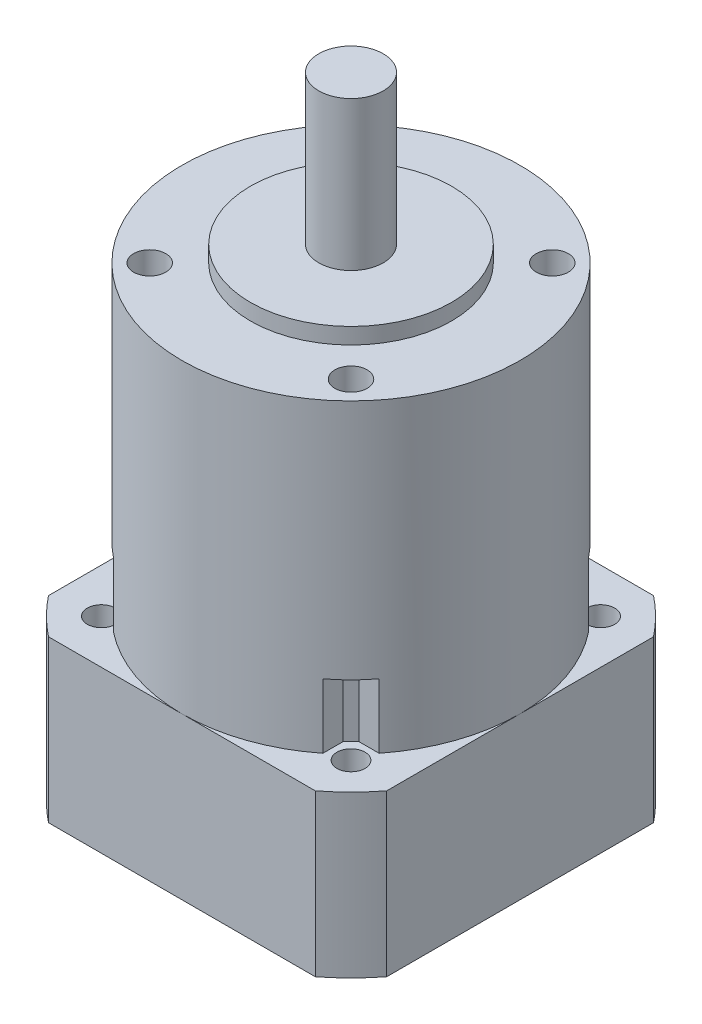
from build123d import *

# Parameters (mm, degrees)
EXTRUDE_1_DEPTH     = 20
SKETCH_2_R          = 21
EXTRUDE_2_DEPTH     = 38
SKETCH_3_R          = 12.5
EXTRUDE_3_DEPTH     = 2
SKETCH_4_R          = 4
EXTRUDE_4_DEPTH     = 18.5
SKETCH_5_R          = 1.75
CUT_EXTRUDE_1_DEPTH = 22.5
SKETCH_6_W          = 5
SKETCH_6_H          = 5
CUT_EXTRUDE_2_DEPTH = 8
CHAMFER_1_SIZE      = 1
SKETCH_7_R          = 12
CUT_EXTRUDE_3_DEPTH = 23
EXTRUDE_5_DEPTH     = 20
SKETCH_9_R          = 2
CUT_EXTRUDE_4_DEPTH = 13


with BuildPart() as part:
    # 草图1 → 凸台-拉伸1 (new body)
    with BuildSketch(Plane(origin=(0, 0, 0), x_dir=(1, 0, 0), z_dir=(0, 1, 0))):
        with BuildLine():
            Line((16.56992758, 21), (-16.56992758, 21))
            ThreePointArc((-16.56992758, 21), (-18.915106397, 18.915106397), (-21, 16.56992758))
            Line((-21, 16.56992758), (-21, -16.56992758))
            ThreePointArc((-21, -16.56992758), (-18.915106397, -18.915106397), (-16.56992758, -21))
            Line((-16.56992758, -21), (16.56992758, -21))
            ThreePointArc((16.56992758, -21), (18.915106397, -18.915106397), (21, -16.56992758))
            Line((21, -16.56992758), (21, 16.56992758))
            ThreePointArc((21, 16.56992758), (18.915106397, 18.915106397), (16.56992758, 21))
        make_face()
    extrude(amount=EXTRUDE_1_DEPTH)

    # 草图2 → 凸台-拉伸2 (add)
    with BuildSketch(Plane(origin=(0, 20, 0), x_dir=(1, 0, 0), z_dir=(0, 1, 0))):
        with Locations(Location((0, 0, 0), (0, 0, 270))):
            Circle(SKETCH_2_R)
    extrude(amount=EXTRUDE_2_DEPTH)

    # 草图3 → 凸台-拉伸3 (add)
    with BuildSketch(Plane(origin=(0, 58, 0), x_dir=(1, 0, 0), z_dir=(0, 1, 0))):
        with Locations(Location((0, 0, 0), (0, 0, 270))):
            Circle(SKETCH_3_R)
    extrude(amount=EXTRUDE_3_DEPTH)

    # 草图4 → 凸台-拉伸4 (add)
    with BuildSketch(Plane(origin=(0, 60, 0), x_dir=(1, 0, 0), z_dir=(0, 1, 0))):
        with Locations(Location((0, 0, 0), (0, 0, 270))):
            Circle(SKETCH_4_R)
    extrude(amount=EXTRUDE_4_DEPTH)

    # 草图5 → 切除-拉伸1 (cut)
    with BuildSketch(Plane.XZ):
        with Locations(Location((15.5, 15.5, 0), (0, 0, 270))):
            Circle(SKETCH_5_R)
        with Locations(Location((15.5, -15.5, 0), (0, 0, 270))):
            Circle(SKETCH_5_R)
        with Locations(Location((-15.5, -15.5, 0), (0, 0, 270))):
            Circle(SKETCH_5_R)
        with Locations(Location((-15.5, 15.5, 0), (0, 0, 270))):
            Circle(SKETCH_5_R)
    extrude(amount=-CUT_EXTRUDE_1_DEPTH, mode=Mode.SUBTRACT)

    # 草图6 → 切除-拉伸2 (cut)
    with BuildSketch(Plane(origin=(0, 20, 0), x_dir=(1, 0, 0), z_dir=(0, 1, 0))):
        with Locations((-15.5, -15.5)):
            Rectangle(SKETCH_6_W, SKETCH_6_H)
        with Locations((15.5, -15.5)):
            Rectangle(SKETCH_6_W, SKETCH_6_H)
        with Locations((-15.5, 15.5)):
            Rectangle(SKETCH_6_W, SKETCH_6_H)
        with Locations((15.5, 15.5)):
            Rectangle(SKETCH_6_W, SKETCH_6_H)
    extrude(amount=CUT_EXTRUDE_2_DEPTH, mode=Mode.SUBTRACT)

    # 倒角1
    chamfer_1_edges = [part.edges().sort_by_distance(p)[0] for p in [
        (13, 24, -13),
        (-13, 24, -13),
        (-13, 24, 13),
        (13, 24, 13),
    ]]
    chamfer(chamfer_1_edges, length=CHAMFER_1_SIZE)

    # 草图7 → 切除-拉伸3 (cut)
    with BuildSketch(Plane.XZ):
        with Locations(Location((0, 0, 0), (0, 0, 270))):
            Circle(SKETCH_7_R)
    extrude(amount=-CUT_EXTRUDE_3_DEPTH, mode=Mode.SUBTRACT)

    # 草图8 → 凸台-拉伸5 (add)
    with BuildSketch(Plane.XZ.offset(-23)):
        with BuildLine():
            ThreePointArc((2.55, 0), (-1.616709621, -1.971991379), (-0.5, 2.50049995))
            Line((-0.5, 2.50049995), (-0.5, 10.988630488))
            ThreePointArc((-0.5, 10.988630488), (-7.599342077, -7.95298686), (11, 0))
            ThreePointArc((11, 0), (7.95298686, 7.599342077), (0.5, 10.988630488))
            Line((0.5, 10.988630488), (0.5, 2.50049995))
            ThreePointArc((0.5, 2.50049995), (1.971991379, 1.616709621), (2.55, 0))
        make_face()
    extrude(amount=EXTRUDE_5_DEPTH)

    # 草图9 → 切除-拉伸4 (cut)
    with BuildSketch(Plane(origin=(0, 58, 0), x_dir=(1, 0, 0), z_dir=(0, 1, 0))):
        with Locations(Location((12.5, 12.5, 0), (0, 0, 270))):
            Circle(SKETCH_9_R)
        with Locations(Location((12.5, -12.5, 0), (0, 0, 270))):
            Circle(SKETCH_9_R)
        with Locations(Location((-12.5, -12.5, 0), (0, 0, 270))):
            Circle(SKETCH_9_R)
        with Locations(Location((-12.5, 12.5, 0), (0, 0, 270))):
            Circle(SKETCH_9_R)
    extrude(amount=-CUT_EXTRUDE_4_DEPTH, mode=Mode.SUBTRACT)


solid = part.part
